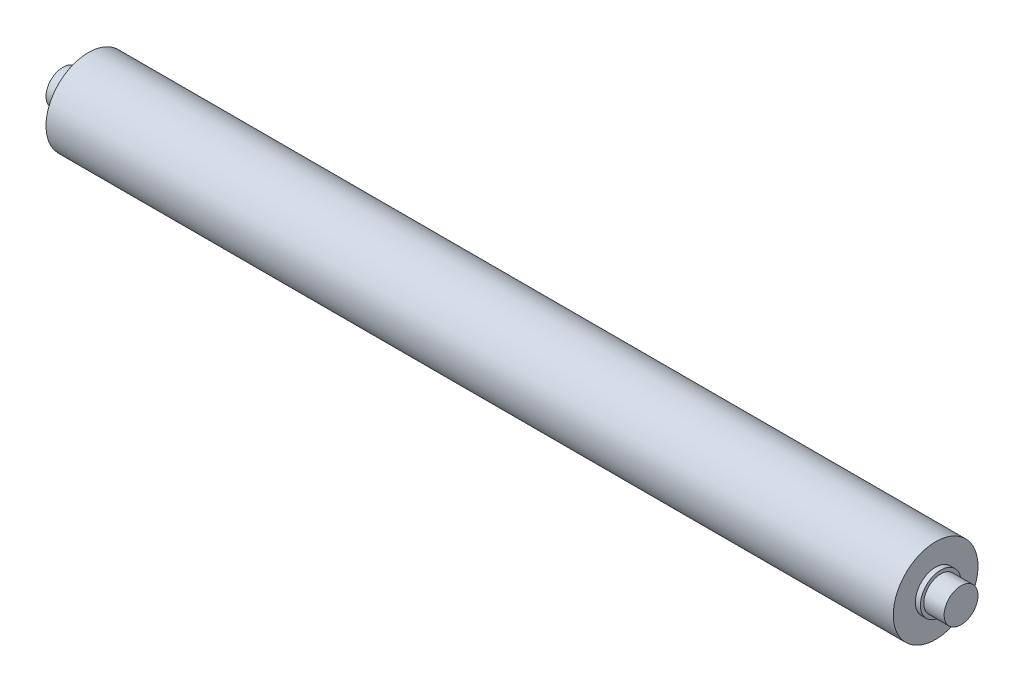
from build123d import *

# Parameters (mm, degrees)
SKETCH_1_W = 494
SKETCH_1_H = 10


with BuildPart() as part:
    # 草图1 → 旋转1 (revolve)
    with BuildSketch(Plane.XY):
        Polygon((-265, 0), (-265, 10), (-253, 10), (-253, 12), (-250, 12), (-250, 25), (250, 25), (250, 12), (253, 12), (253, 10), (265, 10), (265, 0), align=None)
        with Locations((0, 17)):
            Rectangle(SKETCH_1_W, SKETCH_1_H, mode=Mode.SUBTRACT)
    revolve(axis=Axis((265, 0, 0), (-1, 0, 0)))


solid = part.part
